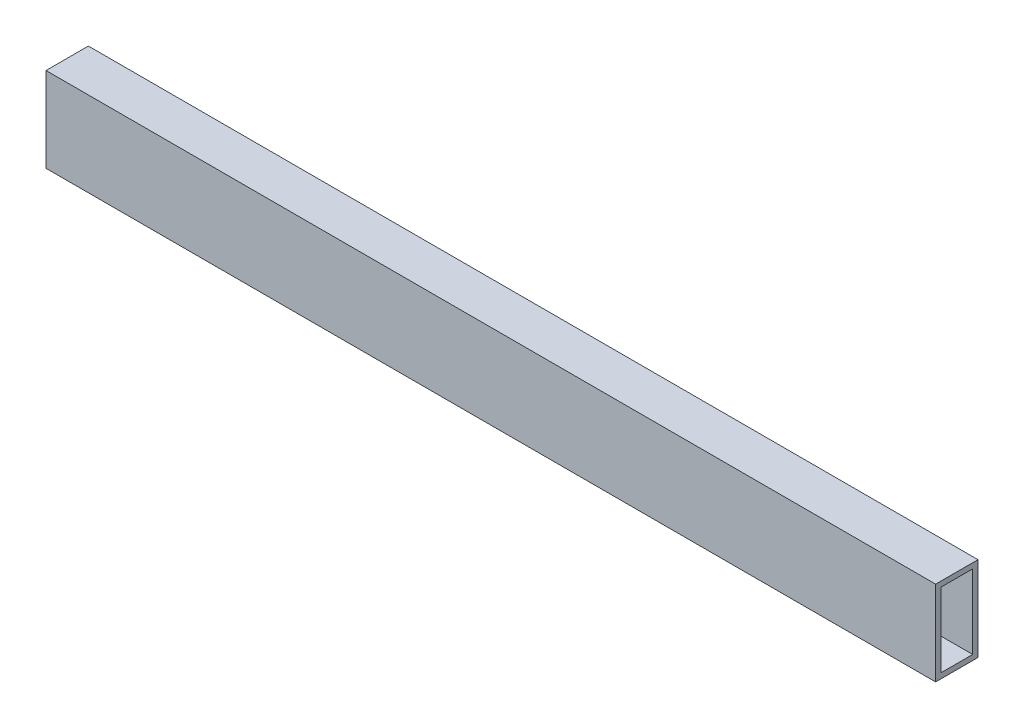
from build123d import *

# Parameters (mm, degrees)
SKETCH1_W           = 25.4
SKETCH1_H           = 50.8
SKETCH1_W_2         = 19.05
SKETCH1_H_2         = 44.45
BOSS_EXTRUDE1_DEPTH = 266.7


with BuildPart() as part:
    # Sketch1 → Boss-Extrude1 (new body)
    with BuildSketch(Plane(origin=(0, 0, 0), x_dir=(0, 0, -1), z_dir=(1, 0, 0))):
        with Locations((-342.9, 0)):
            Rectangle(SKETCH1_W, SKETCH1_H)
        with Locations((-342.9, 0)):
            Rectangle(SKETCH1_W_2, SKETCH1_H_2, mode=Mode.SUBTRACT)
    boss_extrude1 = extrude(amount=BOSS_EXTRUDE1_DEPTH)

    # Mirror1: Boss-Extrude1 across plane
    add(boss_extrude1.mirror(Plane(origin=(0, 0, 0), x_dir=(0, 0, 1), z_dir=(1, 0, 0))))


solid = part.part
